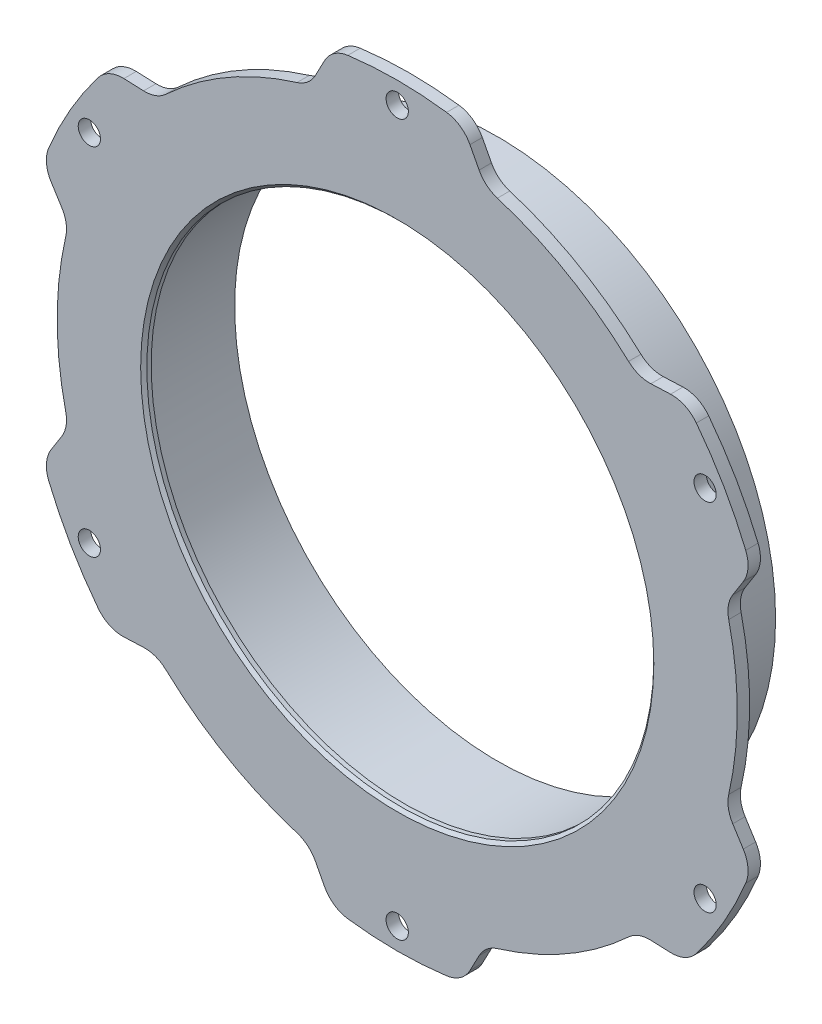
from build123d import *

# Parameters (mm, degrees)
SKETCH4_R          = 2.286
CUT_EXTRUDE1_DEPTH = 112.474173134


with BuildPart() as part:
    # Sketch3 → Revolve1 (revolve)
    with BuildSketch(Plane(origin=(0, 0, 0), x_dir=(0, 0, -1), z_dir=(1, 0, 0)), mode=Mode.PRIVATE) as revolve1_sk:
        with BuildLine():
            Line((0, 77.47), (0, 52.705))
            Line((0, 52.705), (0.635, 52.07))
            Line((0.635, 52.07), (1.524, 52.07))
            Line((1.524, 52.07), (1.524, 53.975))
            Line((1.524, 53.975), (20.574, 53.975))
            Line((20.574, 53.975), (20.574, 57.15))
            Line((20.574, 57.15), (8.89, 57.15))
            ThreePointArc((8.89, 57.15), (4.399871939, 59.009871939), (2.54, 63.5))
            Line((2.54, 63.5), (2.54, 77.47))
            Line((2.54, 77.47), (0, 77.47))
        make_face()
    revolve(revolve1_sk.sketch.rotate(Axis((0, 0, 0), (0, 0, -1)), 90), axis=Axis((0, 0, 0), (0, 0, -1)))

    # Sketch4 → Cut-Extrude1 (cut, through all)
    with BuildSketch(Plane.XY):
        with BuildLine():
            ThreePointArc((10.148016689, 76.802465177), (12.952013431, 75.713278366), (14.940104183, 73.455797294))
            Line((14.940104183, 73.455797294), (16.819480806, 69.871264453))
            ThreePointArc((16.819480806, 69.871264453), (18.384579854, 67.936367662), (20.573091868, 66.751557218))
            ThreePointArc((20.573091868, 66.751557218), (34.925, 60.491874454), (47.521998359, 51.192598801))
            ThreePointArc((47.521998359, 51.192598801), (49.642330309, 49.889697022), (52.100549608, 49.501729883))
            Line((52.100549608, 49.501729883), (56.14453442, 49.666408405))
            ThreePointArc((56.14453442, 49.666408405), (59.093615754, 49.073411844), (61.438877572, 47.189672839))
            ThreePointArc((61.438877572, 47.189672839), (38.735, 67.090988031), (10.148016689, 76.802465177))
        make_face()
        with BuildLine():
            ThreePointArc((-14.940104183, 73.455797294), (-12.952013431, 75.713278366), (-10.148016689, 76.802465177))
            ThreePointArc((-10.148016689, 76.802465177), (-38.735, 67.090988031), (-61.438877572, 47.189672839))
            ThreePointArc((-61.438877572, 47.189672839), (-59.093615754, 49.073411844), (-56.14453442, 49.666408405))
            Line((-56.14453442, 49.666408405), (-52.100549608, 49.501729883))
            ThreePointArc((-52.100549608, 49.501729883), (-49.642330309, 49.889697022), (-47.521998359, 51.192598801))
            ThreePointArc((-47.521998359, 51.192598801), (-34.925, 60.491874454), (-20.573091868, 66.751557218))
            ThreePointArc((-20.573091868, 66.751557218), (-18.384579854, 67.936367662), (-16.819480806, 69.871264453))
            Line((-16.819480806, 69.871264453), (-14.940104183, 73.455797294))
        make_face()
        with BuildLine():
            ThreePointArc((71.586894261, -29.612792338), (77.47, 0), (71.586894261, 29.612792338))
            ThreePointArc((71.586894261, 29.612792338), (72.045629184, 26.639866522), (71.084638604, 23.789388889))
            Line((71.084638604, 23.789388889), (68.920030414, 20.36953457))
            ThreePointArc((68.920030414, 20.36953457), (68.026910163, 18.04667064), (68.095090227, 15.558958417))
            ThreePointArc((68.095090227, 15.558958417), (69.85, 0), (68.095090227, -15.558958417))
            ThreePointArc((68.095090227, -15.558958417), (68.026910163, -18.04667064), (68.920030414, -20.36953457))
            Line((68.920030414, -20.36953457), (71.084638604, -23.789388889))
            ThreePointArc((71.084638604, -23.789388889), (72.045629184, -26.639866522), (71.586894261, -29.612792338))
        make_face()
        with BuildLine():
            ThreePointArc((-71.084638604, 23.789388889), (-72.045629184, 26.639866522), (-71.586894261, 29.612792338))
            ThreePointArc((-71.586894261, 29.612792338), (-77.47, 0), (-71.586894261, -29.612792338))
            ThreePointArc((-71.586894261, -29.612792338), (-72.045629184, -26.639866522), (-71.084638604, -23.789388889))
            Line((-71.084638604, -23.789388889), (-68.920030414, -20.36953457))
            ThreePointArc((-68.920030414, -20.36953457), (-68.026910163, -18.04667064), (-68.095090227, -15.558958417))
            ThreePointArc((-68.095090227, -15.558958417), (-69.85, 0), (-68.095090227, 15.558958417))
            ThreePointArc((-68.095090227, 15.558958417), (-68.026910163, 18.04667064), (-68.920030414, 20.36953457))
            Line((-68.920030414, 20.36953457), (-71.084638604, 23.789388889))
        make_face()
        with BuildLine():
            ThreePointArc((10.148016689, -76.802465177), (38.735, -67.090988031), (61.438877572, -47.189672839))
            ThreePointArc((61.438877572, -47.189672839), (59.093615754, -49.073411844), (56.14453442, -49.666408405))
            Line((56.14453442, -49.666408405), (52.100549608, -49.501729883))
            ThreePointArc((52.100549608, -49.501729883), (49.642330309, -49.889697022), (47.521998359, -51.192598801))
            ThreePointArc((47.521998359, -51.192598801), (34.925, -60.491874454), (20.573091868, -66.751557218))
            ThreePointArc((20.573091868, -66.751557218), (18.384579854, -67.936367662), (16.819480806, -69.871264453))
            Line((16.819480806, -69.871264453), (14.940104183, -73.455797294))
            ThreePointArc((14.940104183, -73.455797294), (12.952013431, -75.713278366), (10.148016689, -76.802465177))
        make_face()
        with BuildLine():
            ThreePointArc((-56.14453442, -49.666408405), (-59.093615754, -49.073411844), (-61.438877572, -47.189672839))
            ThreePointArc((-61.438877572, -47.189672839), (-38.735, -67.090988031), (-10.148016689, -76.802465177))
            ThreePointArc((-10.148016689, -76.802465177), (-12.952013431, -75.713278366), (-14.940104183, -73.455797294))
            Line((-14.940104183, -73.455797294), (-16.819480806, -69.871264453))
            ThreePointArc((-16.819480806, -69.871264453), (-18.384579854, -67.936367662), (-20.573091868, -66.751557218))
            ThreePointArc((-20.573091868, -66.751557218), (-34.925, -60.491874454), (-47.521998359, -51.192598801))
            ThreePointArc((-47.521998359, -51.192598801), (-49.642330309, -49.889697022), (-52.100549608, -49.501729883))
            Line((-52.100549608, -49.501729883), (-56.14453442, -49.666408405))
        make_face()
        with Locations((0, 73.025)):
            Circle(SKETCH4_R)
        with Locations((63.241505111, 36.5125)):
            Circle(SKETCH4_R)
        with Locations((63.241505111, -36.5125)):
            Circle(SKETCH4_R)
        with Locations((0, -73.025)):
            Circle(SKETCH4_R)
        with Locations((-63.241505111, -36.5125)):
            Circle(SKETCH4_R)
        with Locations((-63.241505111, 36.5125)):
            Circle(SKETCH4_R)
    extrude(amount=-CUT_EXTRUDE1_DEPTH, mode=Mode.SUBTRACT)


solid = part.part
